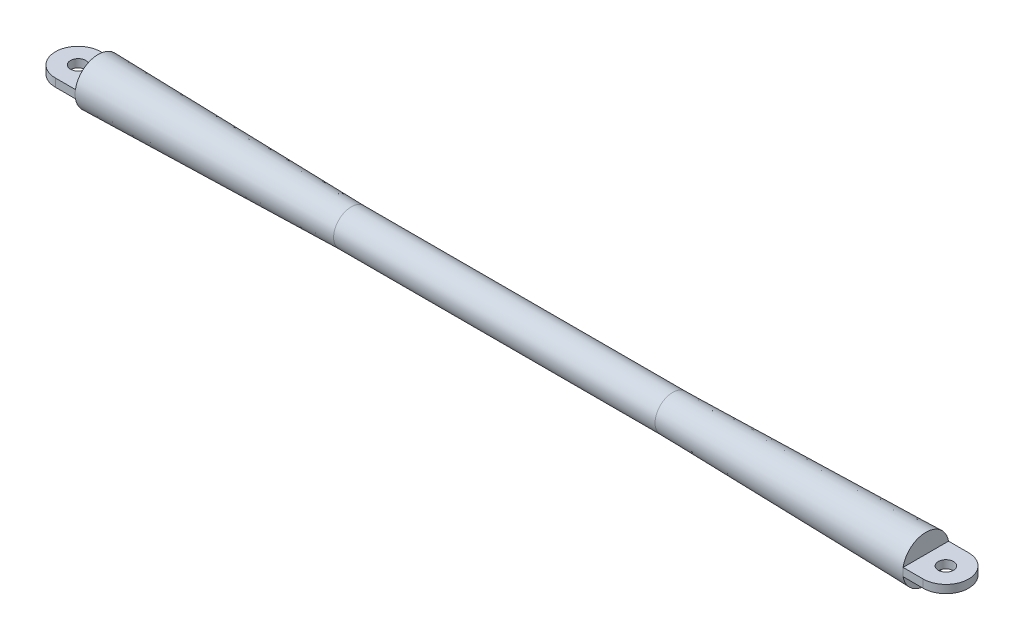
from build123d import *

# Parameters (mm, degrees)
SKETCH3_W          = 100.542277019
SKETCH3_H          = 69.756116378
CUT_EXTRUDE1_DEPTH = 50
CUT_EXTRUDE2_DEPTH = 50
SKETCH5_R          = 9.5
CUT_EXTRUDE3_DEPTH = 571.004949753


with BuildPart() as part:
    # Sketch2 → Revolve1 (revolve)
    with BuildSketch(Plane(origin=(0, 0, 0), x_dir=(1, 0, 0), z_dir=(0, 1, 0)), mode=Mode.PRIVATE) as revolve1_sk:
        Polygon((0, 0), (575, 0), (575, 30), (200, 22), (0, 22), align=None)
    revolve(revolve1_sk.sketch.rotate(Axis((0, 0, 0), (1, 0, 0)), 180), axis=Axis((0, 0, 0), (1, 0, 0)))

    # Sketch3 → Cut-Extrude1 (cut, symmetric)
    with BuildSketch(Plane.XY):
        with Locations((565.27113851, 39.878058189)):
            Rectangle(SKETCH3_W, SKETCH3_H)
        with Locations((565.27113851, -39.878058189)):
            Rectangle(SKETCH3_W, SKETCH3_H)
    extrude(amount=CUT_EXTRUDE1_DEPTH, both=True, mode=Mode.SUBTRACT)

    # Sketch4 → Cut-Extrude2 (cut, symmetric)
    with BuildSketch(Plane(origin=(0, 5, 0), x_dir=(1, 0, 0), z_dir=(0, 1, 0))):
        with BuildLine():
            Line((515, 28.281414392), (540, 28.281414392))
            ThreePointArc((540, 28.281414392), (568.281414392, 0), (540, -28.281414392))
            Line((540, -28.281414392), (515, -28.281414392))
            Line((515, -28.281414392), (515, -51.209465228))
            Line((515, -51.209465228), (609.780087386, -51.209465228))
            Line((609.780087386, -51.209465228), (609.780087386, 50.020401415))
            Line((609.780087386, 50.020401415), (515, 50.020401415))
            Line((515, 50.020401415), (515, 28.281414392))
        make_face()
    extrude(amount=CUT_EXTRUDE2_DEPTH, both=True, mode=Mode.SUBTRACT)

    # Sketch5 → Cut-Extrude3 (cut, through all)
    with BuildSketch(Plane(origin=(0, 5, 0), x_dir=(1, 0, 0), z_dir=(0, 1, 0))):
        with Locations(Location((540, 0, 0), (0, 0, 180))):
            Circle(SKETCH5_R)
    extrude(amount=-CUT_EXTRUDE3_DEPTH, mode=Mode.SUBTRACT)

    # Mirror1: part across plane


with BuildPart() as part_1:
    add(part.part)
    add(part.part.mirror(Plane(origin=(0, 0, -22), x_dir=(0, 0, 1), z_dir=(1, 0, 0))))


solid = part_1.part
